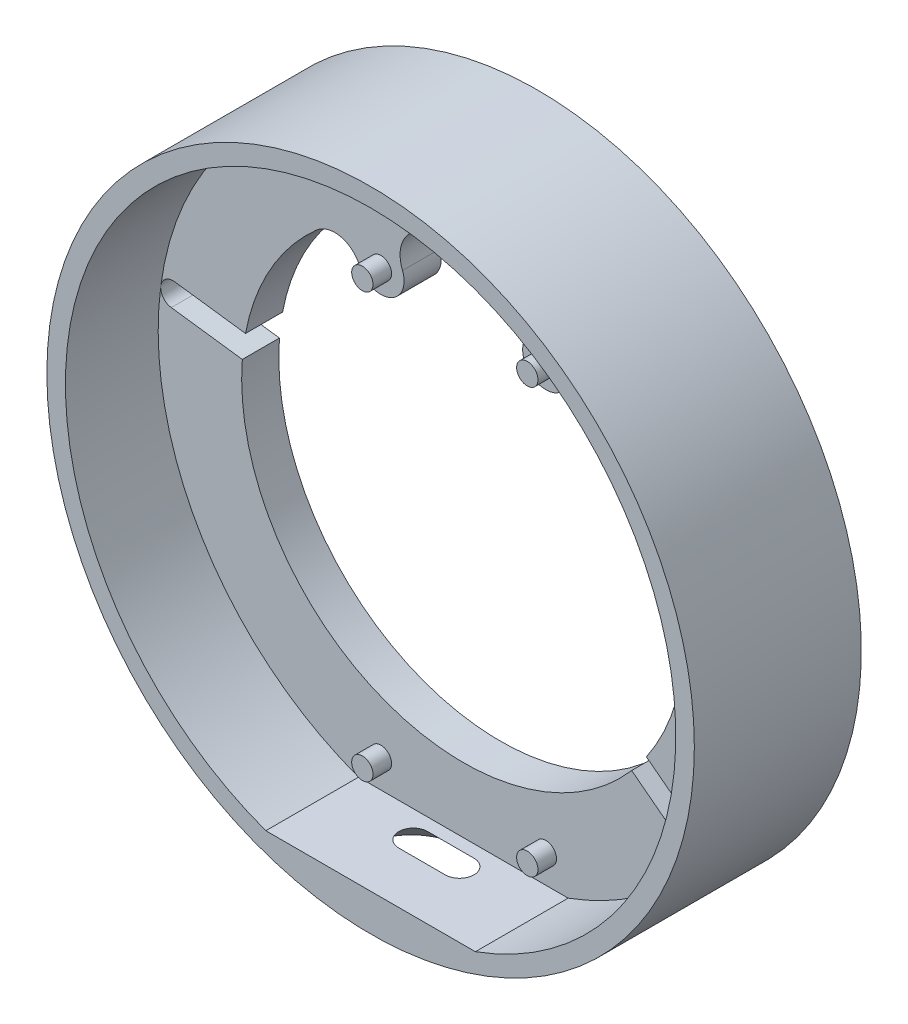
from build123d import *
from build123d.topology import SkipClean

# Parameters (mm, degrees)
ESQUISSE_SUPPORT_R      = 34.9
BOSS_EXTRU_1_DEPTH      = 4
ESQUISSE6_R             = 1.15
BOSS_EXTRU_2_DEPTH      = 2
BOSS_EXTRU_3_START      = 4
ESQUISSE7_R             = 34.9
ESQUISSE7_R_2           = 32.9
BOSS_EXTRU_3_DEPTH      = 4
ESQUISSE8_R             = 34.9
BOSS_EXTRU_5_DEPTH      = 10
ENL_V_MAT_EXTRU_3_DEPTH = 76.786872214
ENL_V_MAT_EXTRU_3_DRAFT = 49


with BuildPart() as part:
    # Esquisse_support → Boss.-Extru.1 (new body)
    with BuildSketch(Plane.XY):
        Circle(ESQUISSE_SUPPORT_R)
        with BuildLine():
            ThreePointArc((-6.559988321, 18.766115653), (-6.450497051, 21.686422251), (-4.183806862, 23.530953235))
            ThreePointArc((-4.183806862, 23.530953235), (0, 23.9), (4.183806862, 23.530953235))
            ThreePointArc((4.183806862, 23.530953235), (6.450497051, 21.686422251), (6.559988321, 18.766115653))
            ThreePointArc((6.559988321, 18.766115653), (7.983884347, 15.529988321), (11.220011679, 16.953884347))
            Line((11.220011679, 16.953884347), (13.517895322, 19.709807357))
            Line((13.517895322, 19.709807357), (18.243699169, 25.871764581))
            ThreePointArc((18.243699169, 25.871764581), (19.084157828, 26.35728211), (20.021764581, 26.106300831))
            ThreePointArc((20.021764581, 26.106300831), (20.50728211, 25.265842172), (20.256300831, 24.328235419))
            Line((20.256300831, 24.328235419), (15.530496983, 18.166278195))
            ThreePointArc((15.530496983, 18.166278195), (23.692512492, 3.142427693), (19.729143793, -13.489658454))
            Line((19.729143793, -13.489658454), (25.863736665, -18.195211742))
            ThreePointArc((25.863736665, -18.195211742), (26.362962372, -19.059550784), (26.104788258, -20.023736665))
            ThreePointArc((26.104788258, -20.023736665), (25.240449216, -20.522962372), (24.276263335, -20.264788258))
            Line((24.276263335, -20.264788258), (18.141670463, -15.559234969))
            ThreePointArc((18.141670463, -15.559234969), (-9.148411266, -22.079777429), (-23.829761597, 1.830973023))
            Line((-23.829761597, 1.830973023), (-31.491348477, 2.843711519))
            ThreePointArc((-31.491348477, 2.843711519), (-32.357776046, 3.344547295), (-32.616288481, 4.311348477))
            ThreePointArc((-32.616288481, 4.311348477), (-32.115452705, 5.177776046), (-31.148651523, 5.436288481))
            Line((-31.148651523, 5.436288481), (-23.487064643, 4.423549986))
            ThreePointArc((-23.487064643, 4.423549986), (-20.799295594, 11.772820511), (-15.881763126, 17.86))
            ThreePointArc((-15.881763126, 17.86), (-13.316845537, 18.611032405), (-11.220011679, 16.953884347))
            ThreePointArc((-11.220011679, 16.953884347), (-7.983884347, 15.529988321), (-6.559988321, 18.766115653))
        make_face(mode=Mode.SUBTRACT)
    extrude(amount=BOSS_EXTRU_1_DEPTH)

    # Esquisse6 → Boss.-Extru.2 (add)
    with BuildSketch(Plane.XY.offset(4)):
        with Locations((-8.89, 17.86)):
            Circle(ESQUISSE6_R)
        with Locations((-8.89, -27.86)):
            Circle(ESQUISSE6_R)
        with Locations(Location((8.89, -27.86, 0), (0, 0, 180))):
            Circle(ESQUISSE6_R)
        with Locations(Location((8.89, 17.86, 0), (0, 0, 180))):
            Circle(ESQUISSE6_R)
    extrude(amount=BOSS_EXTRU_2_DEPTH)

    # Esquisse7 → Boss.-Extru.3 (add)
    with BuildSketch(Plane(origin=(0, 0, 0), x_dir=(-1, 0, 0), z_dir=(0, 0, -1)).offset(BOSS_EXTRU_3_START)):
        Circle(ESQUISSE7_R)
        with Locations(Location((0, 0, 0), (0, 0, 217.490091077))):
            Circle(ESQUISSE7_R_2, mode=Mode.SUBTRACT)
    extrude(amount=-BOSS_EXTRU_3_DEPTH)

    # Esquisse8 → Boss.-Extru.5 (add)
    with BuildSketch(Plane.XY.offset(4)):
        with Locations(Location((0, 0, 0), (0, 0, 180))):
            Circle(ESQUISSE8_R)
        with BuildLine():
            ThreePointArc((-11.296016997, -30.9), (0, 32.9), (11.296016997, -30.9))
            Line((11.296016997, -30.9), (-11.296016997, -30.9))
        make_face(mode=Mode.SUBTRACT)
    extrude(amount=BOSS_EXTRU_5_DEPTH)


with BuildPart() as enl_v_mat_extru_3_tool:
    # Ouverture_USB → Enlèv. mat.-Extru.3 (with draft: the straight prism first)
    with BuildSketch(Plane(origin=(0, -30.9, 0), x_dir=(1, 0, 0), z_dir=(0, 1, 0))):
        with BuildLine():
            ThreePointArc((-2.503983003, -5.349994124), (-4.053983003, -6.899994124), (-2.503983003, -8.449994124))
            Line((-2.503983003, -8.449994124), (2.496016997, -8.449994124))
            ThreePointArc((2.496016997, -8.449994124), (4.046016997, -6.899994124), (2.496016997, -5.349994124))
            Line((2.496016997, -5.349994124), (-2.503983003, -5.349994124))
        make_face()
    extrude(amount=-ENL_V_MAT_EXTRU_3_DEPTH)
    # Enlèv. mat.-Extru.3: the draft: its side faces are tilted about the plane it starts from
    enl_v_mat_extru_3_sides = [enl_v_mat_extru_3_tool.faces().sort_by_distance(p)[0] for p in [
        (-0.003983003, -69.293436107, 5.349994124),
        (-4.053983003, -69.293436107, 6.899994124),
        (-0.003983003, -69.293436107, 8.449994124),
        (4.046016997, -69.293436107, 6.899994124),
    ]]
    draft(enl_v_mat_extru_3_sides, Plane(origin=(0, -30.9, 0), x_dir=(1, 0, 0), z_dir=(0, 1, 0)), ENL_V_MAT_EXTRU_3_DRAFT)


with BuildPart() as part_1:
    add(part.part)

    # Enlèv. mat.-Extru.3: cut by enl_v_mat_extru_3_tool
    add(enl_v_mat_extru_3_tool.part, mode=Mode.SUBTRACT)


solid = part_1.part
